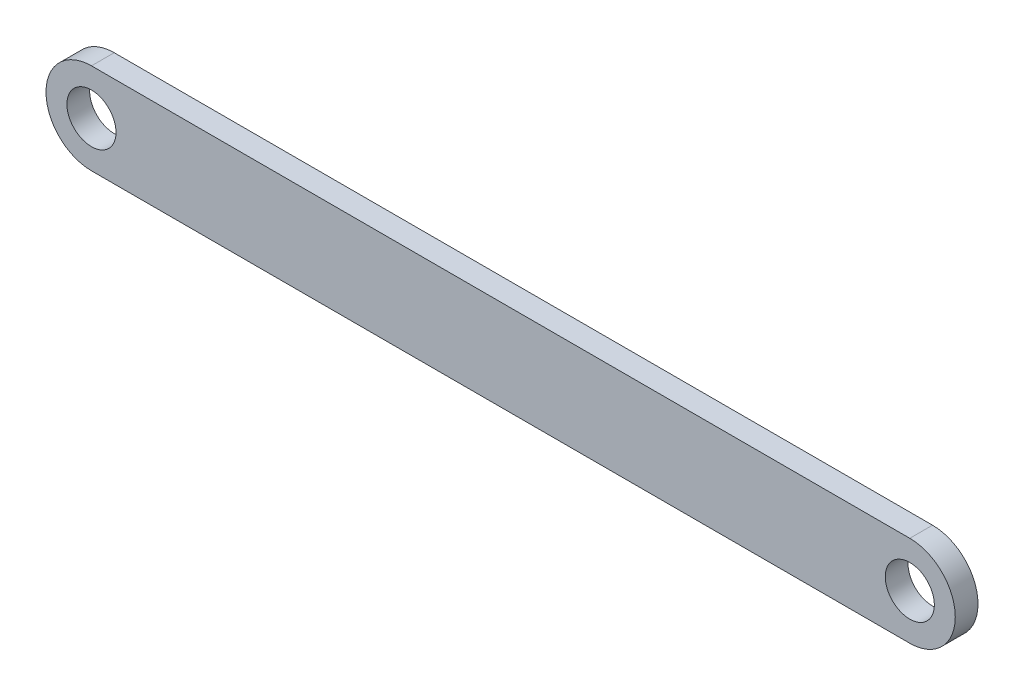
from build123d import *

# Parameters (mm, degrees)
SKETCH1_W           = 200
SKETCH1_H           = 20
BOSS_EXTRUDE1_DEPTH = 5
FILLET1_RADIUS      = 10
FILLET1_LENGTH      = 5
FILLET2_RADIUS      = 10
FILLET2_LENGTH      = 5
SKETCH2_R           = 5.4
CUT_EXTRUDE1_DEPTH  = 5


with BuildPart() as part:
    # Sketch1 → Boss-Extrude1 (new body)
    with BuildSketch(Plane.XY):
        with Locations((100, 10)):
            Rectangle(SKETCH1_W, SKETCH1_H)
    extrude(amount=BOSS_EXTRUDE1_DEPTH)

    # Fillet1: full round fillet: the end face becomes a half cylinder, R = half its width
    fillet1_face = Plane((200, 10, 2.5), x_dir=(0, 0, 1), z_dir=(1, 0, 0))  # on the end face: x along it, z out of the body
    fillet1_slab = fillet1_face.offset(-FILLET1_RADIUS / 2) * Box(FILLET1_LENGTH, 2 * FILLET1_RADIUS, FILLET1_RADIUS, mode=Mode.PRIVATE)  # the body's end, R deep
    fillet1_round = Plane((190, 10, 2.5), x_dir=(1, 0, 0), z_dir=(0, 0, 1)) * Cylinder(FILLET1_RADIUS, FILLET1_LENGTH, mode=Mode.PRIVATE)  # its axis R under the face
    add(fillet1_slab - fillet1_round, mode=Mode.SUBTRACT)

    # Fillet2: full round fillet: the end face becomes a half cylinder, R = half its width
    fillet2_face = Plane((0, 10, 2.5), x_dir=(0, 0, -1), z_dir=(-1, 0, 0))  # on the end face: x along it, z out of the body
    fillet2_slab = fillet2_face.offset(-FILLET2_RADIUS / 2) * Box(FILLET2_LENGTH, 2 * FILLET2_RADIUS, FILLET2_RADIUS, mode=Mode.PRIVATE)  # the body's end, R deep
    fillet2_round = Plane((10, 10, 2.5), x_dir=(-1, 0, 0), z_dir=(0, 0, -1)) * Cylinder(FILLET2_RADIUS, FILLET2_LENGTH, mode=Mode.PRIVATE)  # its axis R under the face
    add(fillet2_slab - fillet2_round, mode=Mode.SUBTRACT)

    # Sketch2 → Cut-Extrude1 (cut)
    with BuildSketch(Plane.XY.offset(5)):
        with Locations((10, 10)):
            Circle(SKETCH2_R)
        with Locations((190, 10)):
            Circle(SKETCH2_R)
    extrude(amount=-CUT_EXTRUDE1_DEPTH, mode=Mode.SUBTRACT)


solid = part.part
